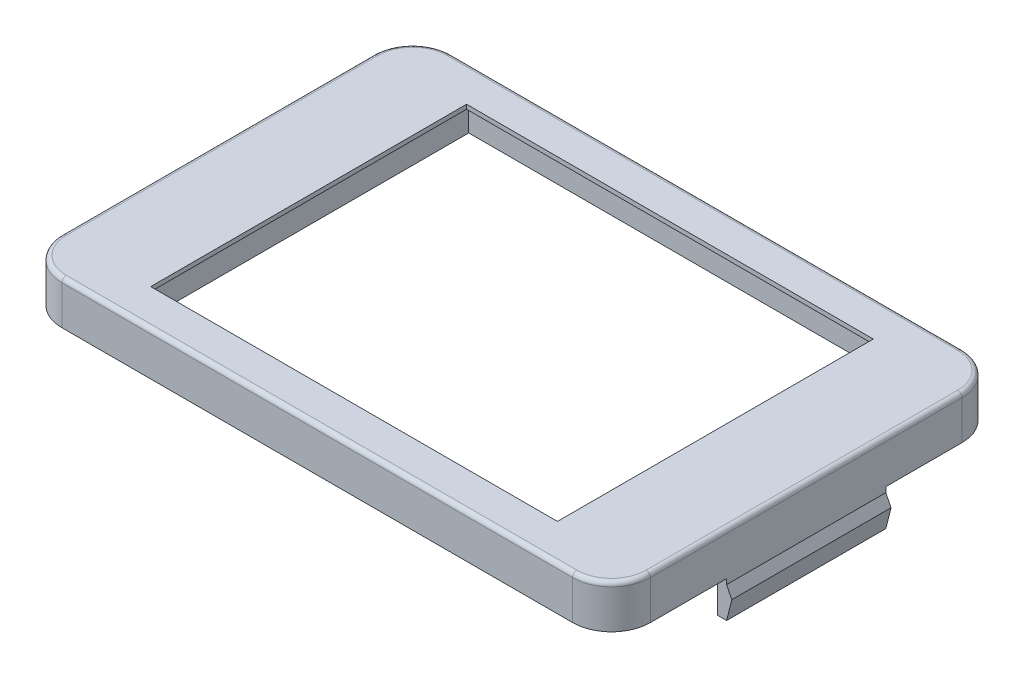
from build123d import *

# Parameters (mm, degrees)
SKETCH1_W               = 68
SKETCH1_H               = 45
SKETCH1_W_2             = 47
SKETCH1_H_2             = 36.5
BOSS_EXTRUDE1_DEPTH     = 5
SKETCH2_W               = 56
SKETCH2_H               = 41
CUT_EXTRUDE1_DEPTH      = 4.5
CUT_EXTRUDE2_DEPTH      = 18.5
CUT_EXTRUDE2_DEPTH_BACK = 18.5
FILLET1_R               = 4.5
FILLET2_R               = 0.5
SKETCH4_W               = 1.046214581
SKETCH4_H               = 18.4
BOSS_EXTRUDE2_DEPTH     = 4.2
BOSS_EXTRUDE3_DEPTH     = 18.4


with BuildPart() as part:
    # Sketch1 → Boss-Extrude1 (new body)
    with BuildSketch(Plane(origin=(0, 0, 0), x_dir=(1, 0, 0), z_dir=(0, 1, 0))):
        Rectangle(SKETCH1_W, SKETCH1_H)
        Rectangle(SKETCH1_W_2, SKETCH1_H_2, mode=Mode.SUBTRACT)
    extrude(amount=BOSS_EXTRUDE1_DEPTH)

    # Sketch2 → Cut-Extrude1 (cut)
    with BuildSketch(Plane.XZ):
        with Locations((2.5, 0)):
            Rectangle(SKETCH2_W, SKETCH2_H)
    extrude(amount=-CUT_EXTRUDE1_DEPTH, mode=Mode.SUBTRACT)

    # Sketch3 → Cut-Extrude2 (cut, two sides: drawn at the far end of the back side and taken through both)
    with BuildSketch(Plane.XY.offset(-CUT_EXTRUDE2_DEPTH_BACK)):
        Polygon((30.5, 4.5), (32.953785419, 0), (30.5, 0), align=None)
    extrude(amount=CUT_EXTRUDE2_DEPTH + CUT_EXTRUDE2_DEPTH_BACK, mode=Mode.SUBTRACT)

    # Fillet1
    fillet1_edges = [part.edges().sort_by_distance(p)[0] for p in [
        (-34, 2.5, -22.5),
        (34, 2.5, -22.5),
        (34, 2.5, 22.5),
        (-34, 2.5, 22.5),
    ]]
    fillet(fillet1_edges, radius=FILLET1_R)

    # Fillet2
    fillet2_edges = [part.edges().sort_by_distance(p)[0] for p in [
        (-34, 5, 0),
        (0, 5, -22.5),
        (0, 5, 22.5),
        (34, 5, 0),
        (32.681980515, 5, 21.181980515),
        (32.681980515, 5, -21.181980515),
        (-32.681980515, 5, 21.181980515),
        (-32.681980515, 5, -21.181980515),
    ]]
    fillet(fillet2_edges, radius=FILLET2_R)

    # Sketch4 → Boss-Extrude2 (add)
    with BuildSketch(Plane.XZ):
        with Locations((33.476892709, 0)):
            Rectangle(SKETCH4_W, SKETCH4_H)
    boss_extrude2 = extrude(amount=BOSS_EXTRUDE2_DEPTH)

    # Sketch5 → Boss-Extrude3 (add)
    with BuildSketch(Plane(origin=(0, 0, -9.2), x_dir=(-1, 0, 0), z_dir=(0, 0, -1))):
        Polygon((-34, -0.6), (-34.6, -1.811446), (-34, -4.2), align=None)
    boss_extrude3 = extrude(amount=-BOSS_EXTRUDE3_DEPTH)

    # Mirror1: Boss-Extrude2, Boss-Extrude3 across plane
    add(boss_extrude2.mirror(Plane(origin=(0, 0, 0), x_dir=(0, 0, 1), z_dir=(1, 0, 0))))
    add(boss_extrude3.mirror(Plane(origin=(0, 0, 0), x_dir=(0, 0, 1), z_dir=(1, 0, 0))))


solid = part.part
